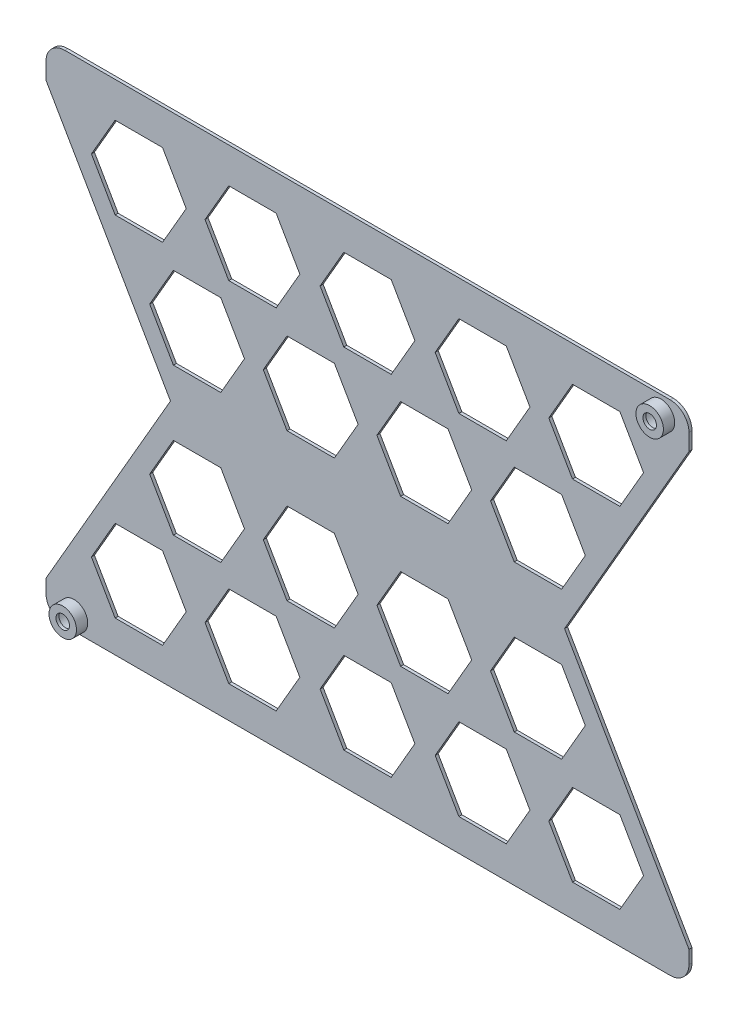
from build123d import *

# Parameters (mm, degrees)
BOSS_EXTRUDE1_DEPTH     = 0.8
CUT_EXTRUDE1_DEPTH      = 145.88389317
CUT_EXTRUDE2_DEPTH      = 145.88389317
MIRROR2_COPY_1_DEPTH    = 145.88389317
MIRROR2_COPY_2_DEPTH    = 145.88389317
FILLET1_R               = 5
SKETCH4_R               = 3.65
BOSS_EXTRUDE4_DEPTH     = 3
CUT_EXTRUDE5_DEPTH      = 145.931509686
CUT_EXTRUDE5_DEPTH_BACK = 145.931509686
SKETCH2_4_R             = 1.8
CUT_EXTRUDE6_DEPTH      = 2.2
CUT_EXTRUDE6_DEPTH_BACK = 145.912740986
SKETCH4_4_R             = 2.85


with BuildPart() as part:
    # Sketch1 → Boss-Extrude1 (new body)
    with BuildSketch(Plane.XY):
        Polygon((85.45, 117), (-85.45, 117), (-85.45, 107.6), (-52.367829575, 50.3), (-85.45, -7), (-85.45, -15.5), (85.45, -15.5), (85.45, -7), (52.367829575, 50.3), (85.45, 107.6), align=None)
    extrude(amount=-BOSS_EXTRUDE1_DEPTH)

    # Sketch1<3> → Cut-Extrude1 (cut, through all)
    with BuildSketch(Plane.XY):
        Polygon((73.377429493, 96.689694505), (67.078361679, 107.6), (54.480226049, 107.6), (48.181158234, 96.689694505), (54.480226049, 85.779389009), (67.078361679, 85.779389009), align=None)
        Polygon((51.593474703, 80.779389009), (38.995339074, 80.779389009), (32.696271259, 69.869083514), (38.995339074, 58.958778018), (51.593474703, 58.958778018), (57.892542518, 69.869083514), align=None)
        Polygon((43.181158234, 96.689694505), (36.88209042, 107.6), (24.28395479, 107.6), (17.984886975, 96.689694505), (24.28395479, 85.779389009), (36.88209042, 85.779389009), align=None)
        Polygon((21.397203444, 80.779389009), (8.799067815, 80.779389009), (2.5, 69.869083514), (8.799067815, 58.958778018), (21.397203444, 58.958778018), (27.696271259, 69.869083514), align=None)
    cut_extrude1 = extrude(amount=-CUT_EXTRUDE1_DEPTH, mode=Mode.SUBTRACT)

    # Sketch1<4> → Cut-Extrude2 (cut, through all)
    with BuildSketch(Plane.XY):
        Polygon((-6.299067815, 107.6), (-12.598135629, 96.689694505), (-6.299067815, 85.779389009), (6.299067815, 85.779389009), (12.598135629, 96.689694505), (6.299067815, 107.6), align=None)
    cut_extrude2 = extrude(amount=-CUT_EXTRUDE2_DEPTH, mode=Mode.SUBTRACT)

    # Mirror1: Cut-Extrude1 across plane
    add(cut_extrude1.mirror(Plane(origin=(0, 0, 0), x_dir=(0, 0, 1), z_dir=(1, 0, 0))), mode=Mode.SUBTRACT)

    # Mirror2: Cut-Extrude2 across plane
    add(cut_extrude2.mirror(Plane(origin=(0, 50.3, 0), x_dir=(0, 0, 1), z_dir=(0, -1, 0))), mode=Mode.SUBTRACT)

    # Mirror2 copy 1 sketch → Mirror2 copy 1 (cut, through all)
    with BuildSketch(Plane(origin=(0, 100.6, 0), x_dir=(-1, 0, 0), z_dir=(0, 0, 1))):
        Polygon((73.377429493, 96.689694505), (67.078361679, 107.6), (54.480226049, 107.6), (48.181158234, 96.689694505), (54.480226049, 85.779389009), (67.078361679, 85.779389009), align=None)
        Polygon((51.593474703, 80.779389009), (38.995339074, 80.779389009), (32.696271259, 69.869083514), (38.995339074, 58.958778018), (51.593474703, 58.958778018), (57.892542518, 69.869083514), align=None)
        Polygon((43.181158234, 96.689694505), (36.88209042, 107.6), (24.28395479, 107.6), (17.984886975, 96.689694505), (24.28395479, 85.779389009), (36.88209042, 85.779389009), align=None)
        Polygon((21.397203444, 80.779389009), (8.799067815, 80.779389009), (2.5, 69.869083514), (8.799067815, 58.958778018), (21.397203444, 58.958778018), (27.696271259, 69.869083514), align=None)
    extrude(amount=-MIRROR2_COPY_1_DEPTH, mode=Mode.SUBTRACT)

    # Mirror2 copy 2 sketch → Mirror2 copy 2 (cut, through all)
    with BuildSketch(Plane(origin=(0, 100.6, 0), x_dir=(1, 0, 0), z_dir=(0, 0, 1))):
        Polygon((73.377429493, -96.689694505), (67.078361679, -107.6), (54.480226049, -107.6), (48.181158234, -96.689694505), (54.480226049, -85.779389009), (67.078361679, -85.779389009), align=None)
        Polygon((51.593474703, -80.779389009), (38.995339074, -80.779389009), (32.696271259, -69.869083514), (38.995339074, -58.958778018), (51.593474703, -58.958778018), (57.892542518, -69.869083514), align=None)
        Polygon((43.181158234, -96.689694505), (36.88209042, -107.6), (24.28395479, -107.6), (17.984886975, -96.689694505), (24.28395479, -85.779389009), (36.88209042, -85.779389009), align=None)
        Polygon((21.397203444, -80.779389009), (8.799067815, -80.779389009), (2.5, -69.869083514), (8.799067815, -58.958778018), (21.397203444, -58.958778018), (27.696271259, -69.869083514), align=None)
    extrude(amount=-MIRROR2_COPY_2_DEPTH, mode=Mode.SUBTRACT)

    # Fillet1
    fillet1_edges = [part.edges().sort_by_distance(p)[0] for p in [
        (85.45, -15.5, -0.4),
        (-85.45, -15.5, -0.4),
        (-85.45, 117, -0.4),
        (85.45, 117, -0.4),
    ]]
    fillet(fillet1_edges, radius=FILLET1_R)

    # Sketch4 → Boss-Extrude4 (add)
    with BuildSketch(Plane.XY):
        with Locations((-78, -11.829016319)):
            Circle(SKETCH4_R)
        with Locations((78, 112.3)):
            Circle(SKETCH4_R)
    extrude(amount=BOSS_EXTRUDE4_DEPTH)

    # Sketch2<4> → Cut-Extrude5 (cut, two sides: drawn at the far end of the back side and taken through both)
    with BuildSketch(Plane(origin=(0, 0, -0.8), x_dir=(-1, 0, 0), z_dir=(0, 0, -1)).offset(-CUT_EXTRUDE5_DEPTH_BACK)):
        with Locations((-78, 112.3)):
            Circle(SKETCH2_4_R)
        with Locations((78, -11.829016319)):
            Circle(SKETCH2_4_R)
    extrude(amount=CUT_EXTRUDE5_DEPTH + CUT_EXTRUDE5_DEPTH_BACK, mode=Mode.SUBTRACT)

    # Sketch4<4> → Cut-Extrude6 (cut, two sides: drawn at the far end of the back side and taken through both)
    with BuildSketch(Plane.XY.offset(-CUT_EXTRUDE6_DEPTH_BACK)):
        with Locations((-78, -11.829016319)):
            Circle(SKETCH4_4_R)
        with Locations((78, 112.3)):
            Circle(SKETCH4_4_R)
    extrude(amount=CUT_EXTRUDE6_DEPTH + CUT_EXTRUDE6_DEPTH_BACK, mode=Mode.SUBTRACT)


solid = part.part
